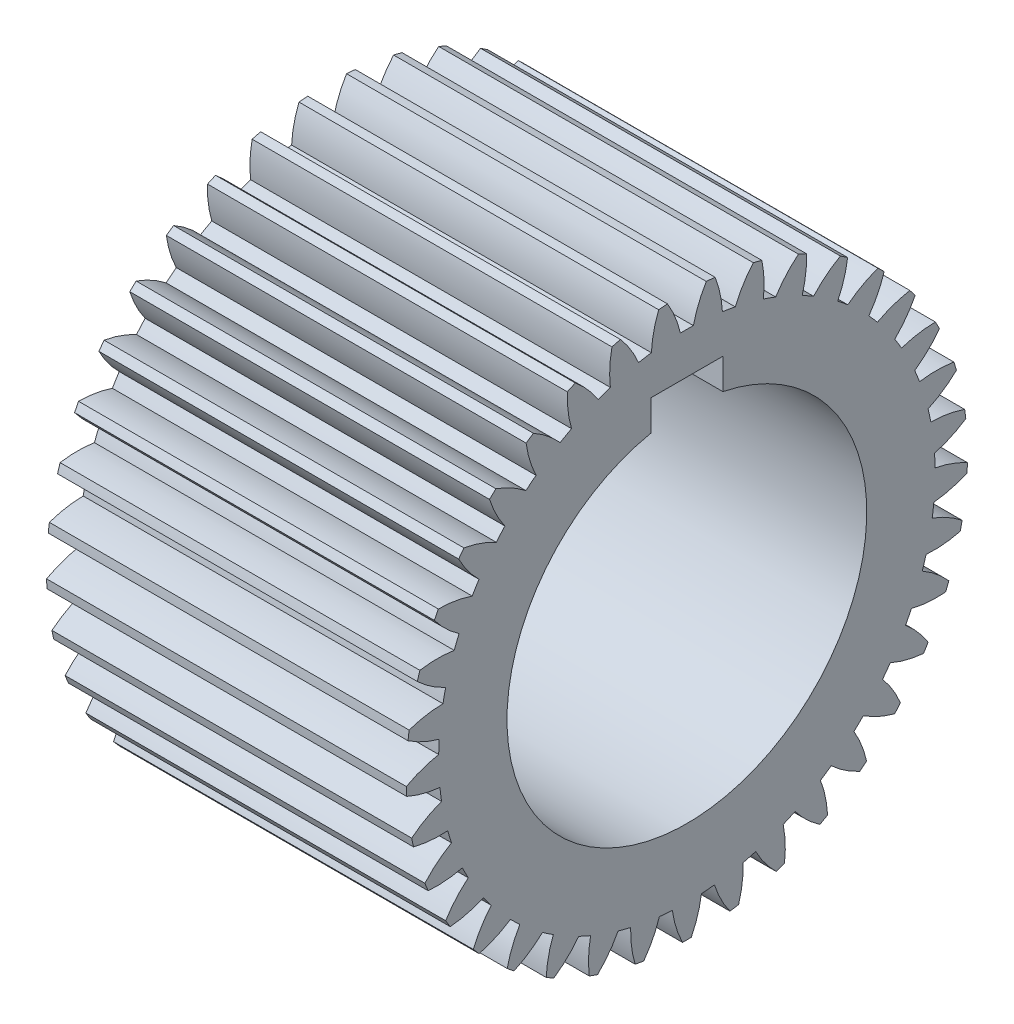
from build123d import *

# Parameters (mm, degrees)
BASPROSKE_W     = 20
BASPROSKE_H     = 15.6
TOOTHCUT_DEPTH  = 30.777844113
TEETHCUTS_COUNT = 37
TEETHCUTS_ANGLE = 350.27027027
BORSKE_R        = 10
BORE_DEPTH      = 50.0000508
KEYSKE_W        = 4
KEYSKE_H        = 11.5
KEYWAY_DEPTH    = 50.0000508


with BuildPart() as part:
    # BasProSke → Base-Revolve (revolve)
    with BuildSketch(Plane(origin=(0, 0, 0), x_dir=(1, 0, 0), z_dir=(0, 1, 0)), mode=Mode.PRIVATE) as base_revolve_sk:
        with Locations((10, 7.8)):
            Rectangle(BASPROSKE_W, BASPROSKE_H)
    revolve(base_revolve_sk.sketch.rotate(Axis((-10, 0, 0), (1, 0, 0)), 180), axis=Axis((-10, 0, 0), (1, 0, 0)))

    # TooCutSke → ToothCut (cut, through all)
    with BuildSketch(Plane(origin=(0, 0, 0), x_dir=(0, 0, -1), z_dir=(1, 0, 0))):
        with BuildLine():
            ThreePointArc((0.361744977, 13.794257558), (0, 13.799), (-0.361744977, 13.794257558))
            ThreePointArc((-0.361744977, 13.794257558), (-0.654227189, 14.720805223), (-1.094326155, 15.587032284))
            ThreePointArc((-1.094326155, 15.587032284), (0, 15.6254), (1.094326155, 15.587032284))
            ThreePointArc((1.094326155, 15.587032284), (0.654227189, 14.720805223), (0.361744977, 13.794257558))
        make_face()
    toothcut = extrude(amount=TOOTHCUT_DEPTH, mode=Mode.SUBTRACT)

    # TeethCuts: ToothCut ×37 about axis
    teethcuts_axis = Axis((-10, 0, 0), (1, 0, 0))
    for i in range(1, TEETHCUTS_COUNT):
        add(toothcut.rotate(teethcuts_axis, i * TEETHCUTS_ANGLE / (TEETHCUTS_COUNT - 1)), mode=Mode.SUBTRACT)

    # BorSke → Bore (cut, symmetric)
    with BuildSketch(Plane(origin=(0, 0, 0), x_dir=(0, 0, -1), z_dir=(1, 0, 0))):
        with Locations(Location((0, 0, 0), (0, 0, 180))):
            Circle(BORSKE_R)
    extrude(amount=BORE_DEPTH, both=True, mode=Mode.SUBTRACT)

    # KeySke → Keyway (cut, symmetric)
    with BuildSketch(Plane(origin=(0, 0, 0), x_dir=(0, 0, -1), z_dir=(1, 0, 0))):
        with Locations((0, 5.75)):
            Rectangle(KEYSKE_W, KEYSKE_H)
    extrude(amount=KEYWAY_DEPTH, both=True, mode=Mode.SUBTRACT)


solid = part.part
